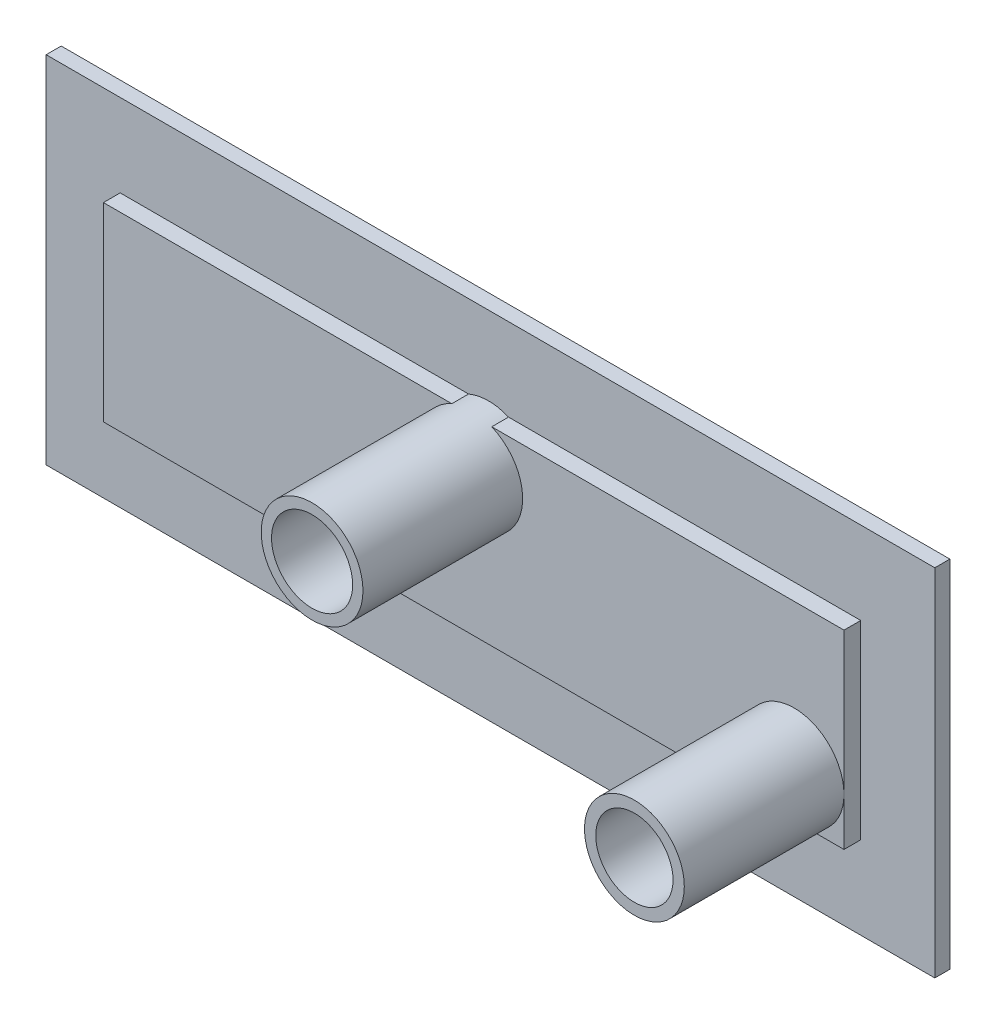
from build123d import *

# Parameters (mm, degrees)
BOSS_EXTRUDE1_DEPTH     = 2.9718
BOSS_EXTRUDE2_DEPTH     = 3.302
BOSS_EXTRUDE3_DEPTH     = 10.668
SKETCH5_R               = 10.033
BOSS_EXTRUDE4_DEPTH     = 34.798
SKETCH4_R               = 9.8425
BOSS_EXTRUDE5_DEPTH     = 34.798
CUT_EXTRUDE1_DEPTH      = 107.07801353
CUT_EXTRUDE1_DEPTH_BACK = 107.07801353
SKETCH6_R               = 7.62
SKETCH6_R_2             = 8.001


with BuildPart() as part:
    # Sketch1 → Boss-Extrude1 (new body)
    with BuildSketch(Plane.XY):
        Polygon((-87.63, 35.03295), (87.63, 35.03295), (87.63, 0), (87.63, -35.03295), (0, -35.03295), (-87.63, -35.03295), (-87.63, 0), align=None)
    extrude(amount=BOSS_EXTRUDE1_DEPTH)

    # Sketch2 → Boss-Extrude2 (add)
    with BuildSketch(Plane.XY.offset(2.9718)):
        Polygon((-73.025, 18.7325), (73.025, 18.7325), (73.025, 0), (73.025, -18.7325), (0, -18.7325), (-73.025, -18.7325), (-73.025, 0), align=None)
    extrude(amount=BOSS_EXTRUDE2_DEPTH)

    # Sketch3 → Boss-Extrude3 (add)
    with BuildSketch(Plane(origin=(0, 0, 0), x_dir=(-1, 0, 0), z_dir=(0, 0, -1))):
        Polygon((-75.438, 21.209), (75.438, 21.209), (75.438, 0), (75.438, -21.209), (0, -21.209), (-75.438, -21.209), (-75.438, 0), align=None)
    extrude(amount=BOSS_EXTRUDE3_DEPTH)

    # Sketch5 → Boss-Extrude4 (add)
    with BuildSketch(Plane.XY.offset(2.9718)):
        with Locations(Location((-0.381, 9.50595, 0), (0, 0, 113.129371467))):
            Circle(SKETCH5_R)
    extrude(amount=BOSS_EXTRUDE4_DEPTH)

    # Sketch4 → Boss-Extrude5 (add)
    with BuildSketch(Plane.XY.offset(2.9718)):
        with Locations((63.1825, -9.31545)):
            Circle(SKETCH4_R)
    extrude(amount=BOSS_EXTRUDE5_DEPTH)

    # Sketch6 → Cut-Extrude1 (cut, two sides: drawn at the far end of the back side and taken through both)
    with BuildSketch(Plane.XY.offset(37.7698).offset(-CUT_EXTRUDE1_DEPTH_BACK)):
        with Locations((63.1825, -9.31545)):
            Circle(SKETCH6_R)
        with Locations((-0.381, 9.50595)):
            Circle(SKETCH6_R_2)
    extrude(amount=CUT_EXTRUDE1_DEPTH + CUT_EXTRUDE1_DEPTH_BACK, mode=Mode.SUBTRACT)


solid = part.part
